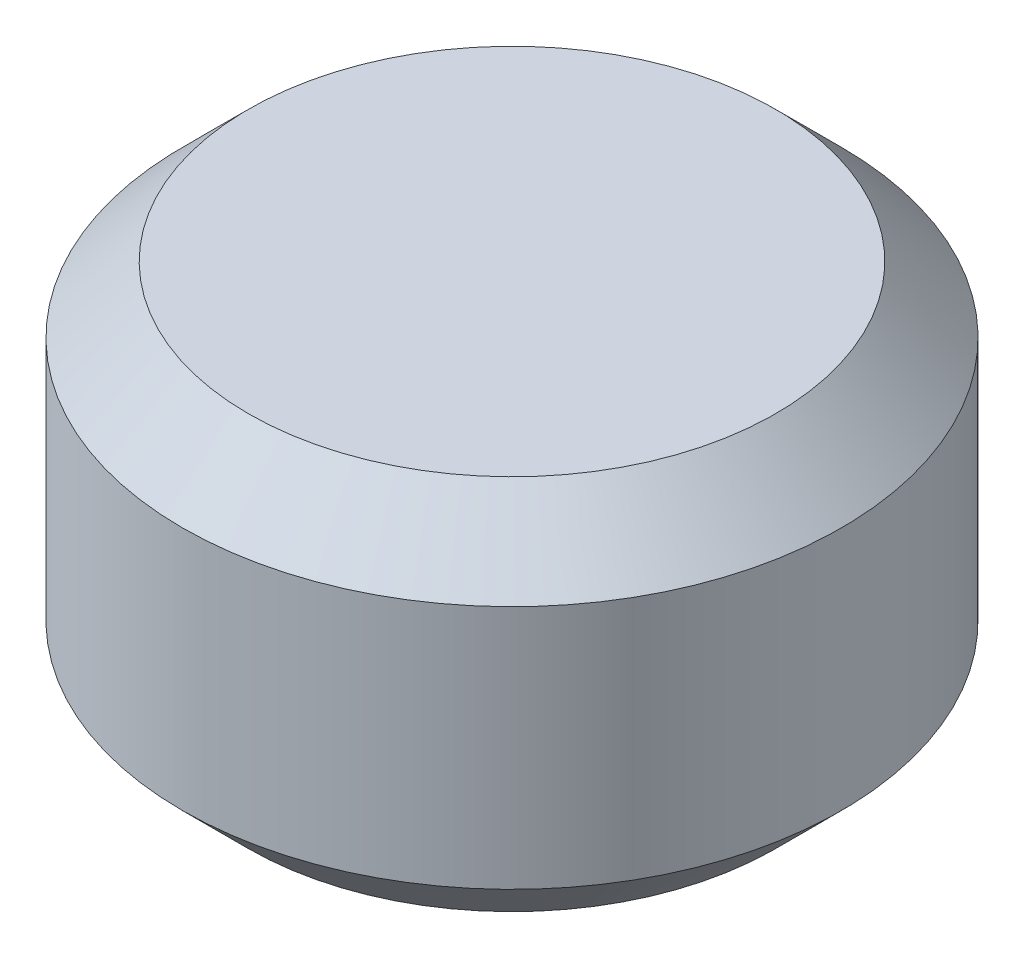
from build123d import *

# Parameters (mm, degrees)
SKETCH1_R           = 1.75
BOSS_EXTRUDE1_DEPTH = 2
CHAMFER1_SIZE       = 0.35


with BuildPart() as part:
    # Sketch1 → Boss-Extrude1 (new body)
    with BuildSketch(Plane(origin=(0, 0, 0), x_dir=(1, 0, 0), z_dir=(0, 1, 0))):
        with Locations(Location((0, 0, 0), (0, 0, 270))):
            Circle(SKETCH1_R)
    extrude(amount=BOSS_EXTRUDE1_DEPTH)

    # Chamfer1
    chamfer1_edges = [part.edges().sort_by_distance(p)[0] for p in [
        (0, 0, -1.75),
        (0, 2, -1.75),
    ]]
    chamfer(chamfer1_edges, length=CHAMFER1_SIZE)


solid = part.part
